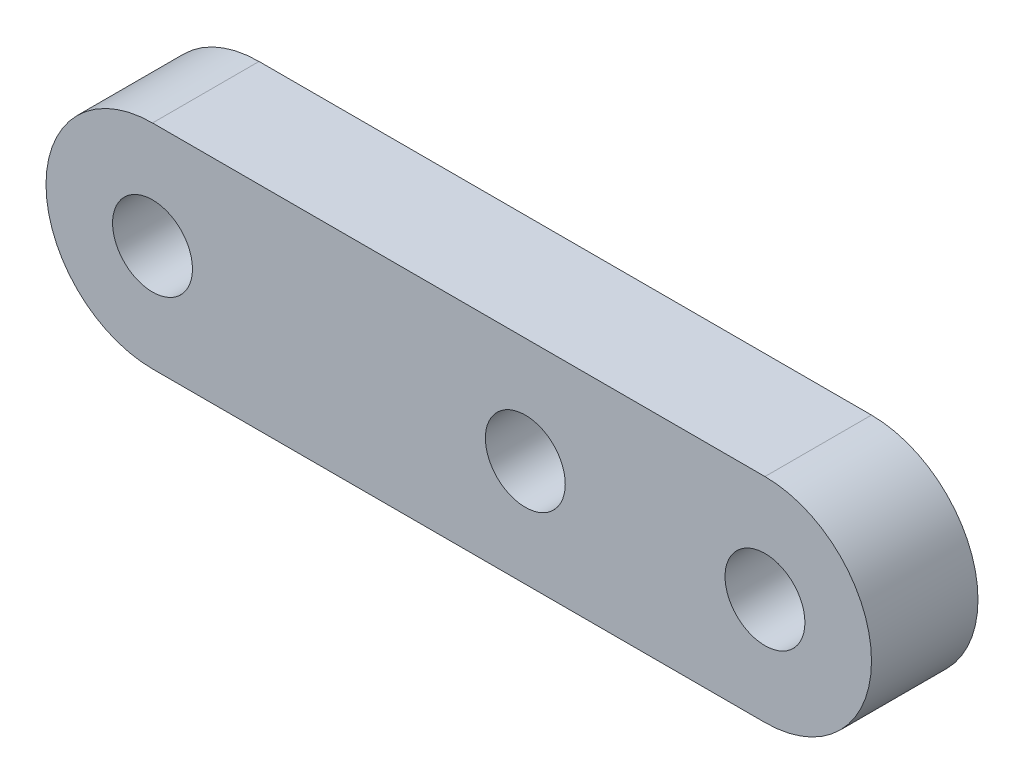
from build123d import *

# Parameters (mm, degrees)
SKETCH_1_R      = 1.5
EXTRUDE_1_DEPTH = 4


with BuildPart() as part:
    # 草图1 → 凸台-拉伸1 (new body)
    with BuildSketch(Plane.XY):
        with BuildLine():
            Line((0, 4), (23, 4))
            ThreePointArc((23, 4), (27, 0), (23, -4))
            Line((23, -4), (0, -4))
            ThreePointArc((0, -4), (-4, 0), (0, 4))
        make_face()
        Circle(SKETCH_1_R, mode=Mode.SUBTRACT)
        with Locations((14, 0)):
            Circle(SKETCH_1_R, mode=Mode.SUBTRACT)
        with Locations((23, 0)):
            Circle(SKETCH_1_R, mode=Mode.SUBTRACT)
    extrude(amount=EXTRUDE_1_DEPTH)


solid = part.part
